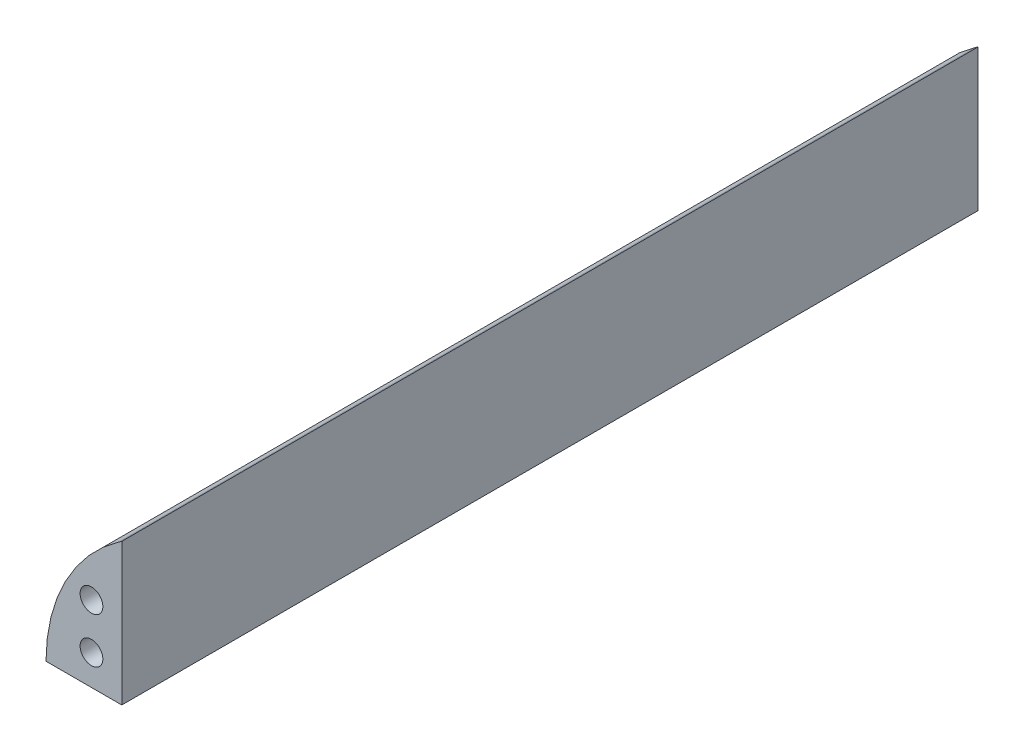
from build123d import *

# Parameters (mm, degrees)
RESSALTO_EXTRUS_O1_DEPTH = 113
ESBO_O2_R                = 1.5
CORTE_EXTRUS_O1_DEPTH    = 113


with BuildPart() as part:
    # Esboço1 → Ressalto-extrusão1 (new body)
    with BuildSketch(Plane.XY):
        Polygon((11.5, 30.979337094), (21.5, 30.979337094), (21.5, 49.687624028), (21.161059666, 49.456664041), (19.066345307, 47.808952584), (17.161004874, 45.902414631), (15.486453, 43.765993321), (14.074906639, 41.431162512), (12.967287062, 38.97151993), (12.155978451, 36.372733292), (11.660337074, 33.660653998), align=None)
    extrude(amount=RESSALTO_EXTRUS_O1_DEPTH)

    # Esboço2 → Corte-extrusão1 (cut)
    with BuildSketch(Plane.XY.offset(113)):
        with Locations((17.5, 34.979337094)):
            Circle(ESBO_O2_R)
        with Locations((17.5, 40.979337094)):
            Circle(ESBO_O2_R)
    extrude(amount=-CORTE_EXTRUS_O1_DEPTH, mode=Mode.SUBTRACT)


solid = part.part
